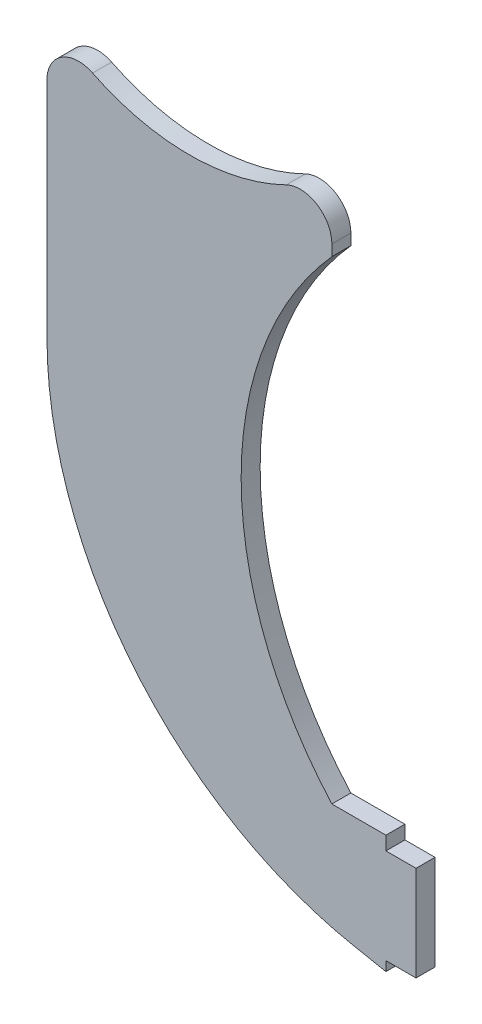
from build123d import *

# Parameters (mm, degrees)
BOSS_EXTRUDE1_DEPTH = 6
FILLET1_R           = 10
FILLET2_R           = 10


with BuildPart() as part:
    # Sketch1 → Boss-Extrude1 (new body)
    with BuildSketch(Plane.XY):
        with BuildLine():
            Line((-79.123154231, -194.789726066), (-79.123154231, -164.789726066))
            Line((-79.123154231, -164.789726066), (-88.623154231, -164.789726066))
            Line((-88.623154231, -164.789726066), (-88.623154231, -160.48699252))
            Line((-88.623154231, -160.48699252), (-105.686834952, -160.48699252))
            ThreePointArc((-105.686834952, -160.48699252), (-134.328154399, -85.664912136), (-105.686834952, -10.842831751))
            Line((-105.686834952, -10.842831751), (-105.686834952, 11.052996518))
            ThreePointArc((-105.686834952, 11.052996518), (-150.657550595, -5.512129368), (-195.628266239, 11.052996518))
            Line((-195.628266239, 11.052996518), (-195.628266239, -78.076028691))
            ThreePointArc((-195.628266239, -78.076028691), (-168.199517459, -154.434154962), (-98.45220878, -195.885483519))
            Line((-98.45220878, -195.885483519), (-88.623154231, -197.789726066))
            Line((-88.623154231, -197.789726066), (-88.623154231, -194.789726066))
            Line((-88.623154231, -194.789726066), (-79.123154231, -194.789726066))
        make_face()
    extrude(amount=BOSS_EXTRUDE1_DEPTH)

    # Fillet1
    fillet1_edges = [part.edges().sort_by_distance(p)[0] for p in [
        (-195.628266239, 11.052996518, 3),
    ]]
    fillet(fillet1_edges, radius=FILLET1_R)

    # Fillet2
    fillet2_edges = [part.edges().sort_by_distance(p)[0] for p in [
        (-105.686834952, 11.052996518, 3),
    ]]
    fillet(fillet2_edges, radius=FILLET2_R)


solid = part.part
